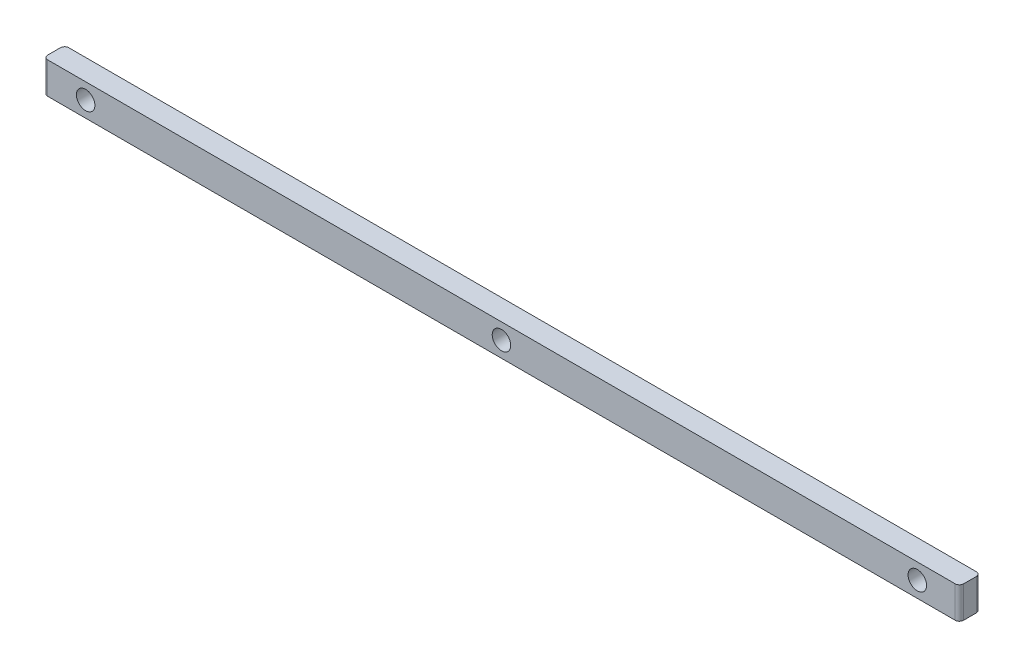
from build123d import *

# Parameters (mm, degrees)
SKETCH1_W               = 552.45
SKETCH1_H               = 19.05
BOSS_EXTRUDE1_DEPTH     = 6.35
CUT_EXTRUDE1_DEPTH      = 277.680802099
CUT_EXTRUDE1_DEPTH_BACK = 277.680802099
SKETCH2_R               = 5.588
FILLET1_R               = 2.54


with BuildPart() as part:
    # Sketch1 → Boss-Extrude1 (new, symmetric)
    with BuildSketch(Plane.XY):
        Rectangle(SKETCH1_W, SKETCH1_H)
    extrude(amount=BOSS_EXTRUDE1_DEPTH, both=True)

    # Sketch2 → Cut-Extrude1 (cut, two sides: drawn at the far end of the back side and taken through both)
    with BuildSketch(Plane.XY.offset(6.35).offset(-CUT_EXTRUDE1_DEPTH_BACK)):
        Circle(SKETCH2_R)
        with Locations((250.825, 0)):
            Circle(SKETCH2_R)
        with Locations((-250.825, 0)):
            Circle(SKETCH2_R)
    extrude(amount=CUT_EXTRUDE1_DEPTH + CUT_EXTRUDE1_DEPTH_BACK, mode=Mode.SUBTRACT)

    # Fillet1
    fillet1_edges = [part.edges().sort_by_distance(p)[0] for p in [
        (-276.225, 0, 6.35),
        (276.225, 0, 6.35),
        (-276.225, 0, -6.35),
        (276.225, 0, -6.35),
    ]]
    fillet(fillet1_edges, radius=FILLET1_R)


solid = part.part
